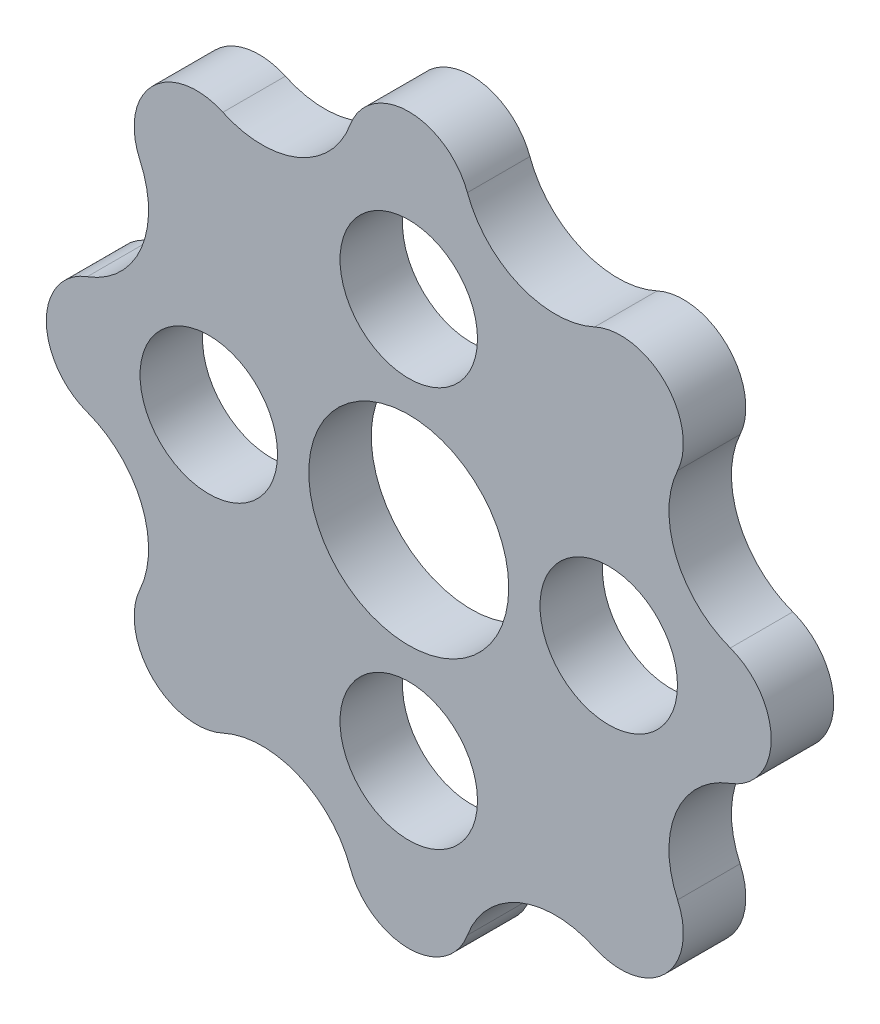
from build123d import *

# Parameters (mm, degrees)
EXTRUDE_1_DEPTH     = 10
SKETCH_2_R          = 16
SKETCH_2_R_2        = 11
CUT_EXTRUDE_1_DEPTH = 10


with BuildPart() as part:
    # 草图1 → 凸台-拉伸1 (new body)
    with BuildSketch(Plane.XY):
        with BuildLine():
            ThreePointArc((9.384103149, 51.455229093), (0, 58), (-9.384103149, 51.455229093))
            ThreePointArc((-9.384103149, 51.455229093), (-17.720006387, 42.779879746), (-29.748778447, 43.019904391))
            ThreePointArc((-29.748778447, 43.019904391), (-41.012193309, 41.012193309), (-43.019904391, 29.748778447))
            ThreePointArc((-43.019904391, 29.748778447), (-42.779879746, 17.720006387), (-51.455229093, 9.384103149))
            ThreePointArc((-51.455229093, 9.384103149), (-58, 0), (-51.455229093, -9.384103149))
            ThreePointArc((-51.455229093, -9.384103149), (-42.779879746, -17.720006387), (-43.019904391, -29.748778447))
            ThreePointArc((-43.019904391, -29.748778447), (-41.012193309, -41.012193309), (-29.748778447, -43.019904391))
            ThreePointArc((-29.748778447, -43.019904391), (-17.720006387, -42.779879746), (-9.384103149, -51.455229093))
            ThreePointArc((-9.384103149, -51.455229093), (0, -58), (9.384103149, -51.455229093))
            ThreePointArc((9.384103149, -51.455229093), (17.720006387, -42.779879746), (29.748778447, -43.019904391))
            ThreePointArc((29.748778447, -43.019904391), (41.012193309, -41.012193309), (43.019904391, -29.748778447))
            ThreePointArc((43.019904391, -29.748778447), (42.779879746, -17.720006387), (51.455229093, -9.384103149))
            ThreePointArc((51.455229093, -9.384103149), (58, 0), (51.455229093, 9.384103149))
            ThreePointArc((51.455229093, 9.384103149), (42.779879746, 17.720006387), (43.019904391, 29.748778447))
            ThreePointArc((43.019904391, 29.748778447), (41.012193309, 41.012193309), (29.748778447, 43.019904391))
            ThreePointArc((29.748778447, 43.019904391), (17.720006387, 42.779879746), (9.384103149, 51.455229093))
        make_face()
    extrude(amount=EXTRUDE_1_DEPTH)

    # 草图2 → 切除-拉伸1 (cut)
    with BuildSketch(Plane.XY.offset(10)):
        Circle(SKETCH_2_R)
        with Locations((0, 32)):
            Circle(SKETCH_2_R_2)
        with Locations((32, 0)):
            Circle(SKETCH_2_R_2)
        with Locations((0, -32)):
            Circle(SKETCH_2_R_2)
        with Locations((-32, 0)):
            Circle(SKETCH_2_R_2)
    extrude(amount=-CUT_EXTRUDE_1_DEPTH, mode=Mode.SUBTRACT)


solid = part.part
